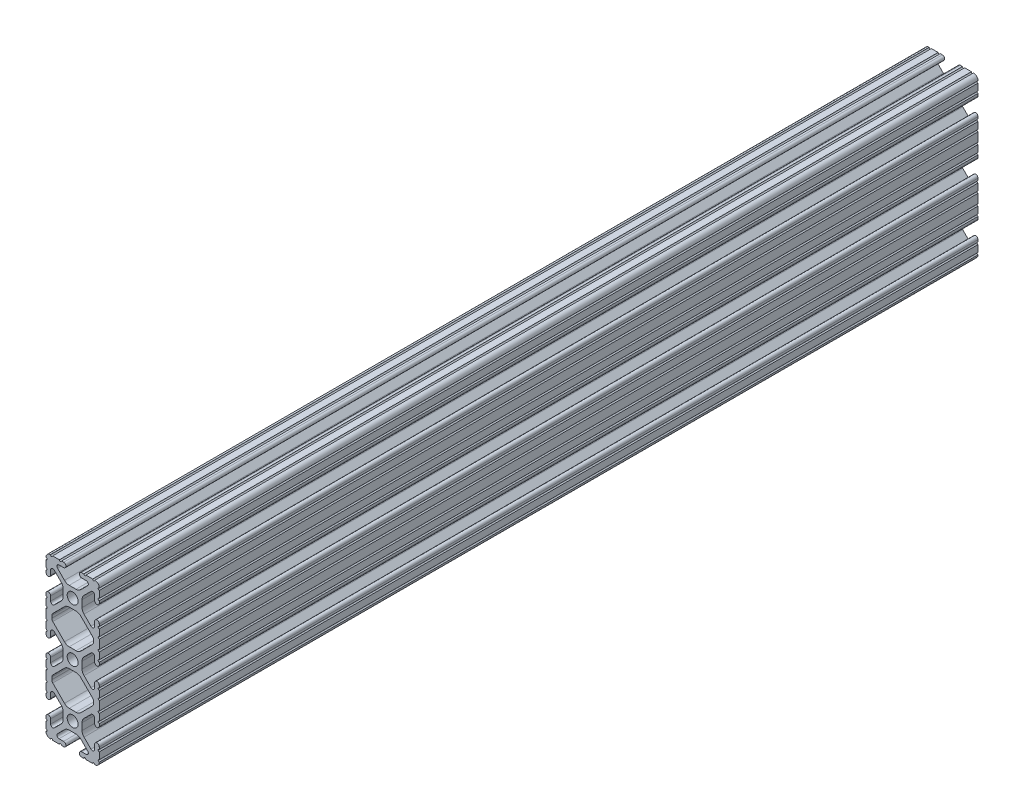
from build123d import *

# Parameters (mm, degrees)
SKETCH1_R           = 2.6035
BOSS_EXTRUDE1_DEPTH = 419.1


with BuildPart() as part:
    # Sketch1 → Boss-Extrude1 (new body)
    with BuildSketch(Plane.XY):
        with BuildLine():
            Line((-6.3246, 38.1), (-9.5504, 38.1))
            ThreePointArc((-9.5504, 38.1), (-10.0584, 37.592), (-10.5664, 38.1))
            ThreePointArc((-10.5664, 38.1), (-12.082677406, 37.482677406), (-12.7, 35.9664))
            ThreePointArc((-12.7, 35.9664), (-12.192, 35.4584), (-12.7, 34.9504))
            Line((-12.7, 34.9504), (-12.7, 31.7246))
            ThreePointArc((-12.7, 31.7246), (-12.192, 31.2166), (-12.7, 30.7086))
            Line((-12.7, 30.7086), (-12.7, 29.702307889))
            ThreePointArc((-12.7, 29.702307889), (-11.5951, 28.597407889), (-10.4902, 29.702307889))
            Line((-10.4902, 29.702307889), (-10.4902, 31.874794456))
            ThreePointArc((-10.4902, 31.874794456), (-9.863006367, 32.813456061), (-8.75577951, 32.593214945))
            Line((-8.75577951, 32.593214945), (-5.43843597, 29.275871405))
            ThreePointArc((-5.43843597, 29.275871405), (-4.750182484, 28.245827272), (-4.5085, 27.030807374))
            Line((-4.5085, 27.030807374), (-4.5085, 23.769192626))
            ThreePointArc((-4.5085, 23.769192626), (-4.750182484, 22.554172728), (-5.43843597, 21.524128595))
            Line((-5.43843597, 21.524128595), (-8.75577951, 18.206785055))
            ThreePointArc((-8.75577951, 18.206785055), (-9.863006367, 17.986543939), (-10.4902, 18.925205544))
            Line((-10.4902, 18.925205544), (-10.4902, 21.097692111))
            ThreePointArc((-10.4902, 21.097692111), (-11.5951, 22.202592111), (-12.7, 21.097692111))
            Line((-12.7, 21.097692111), (-12.7, 20.0914))
            ThreePointArc((-12.7, 20.0914), (-12.192, 19.5834), (-12.7, 19.0754))
            Line((-12.7, 19.0754), (-12.7, 15.8496))
            ThreePointArc((-12.7, 15.8496), (-12.192, 15.3416), (-12.7, 14.8336))
            Line((-12.7, 14.8336), (-12.7, 10.5664))
            ThreePointArc((-12.7, 10.5664), (-12.192, 10.0584), (-12.7, 9.5504))
            Line((-12.7, 9.5504), (-12.7, 6.3246))
            ThreePointArc((-12.7, 6.3246), (-12.192, 5.8166), (-12.7, 5.3086))
            Line((-12.7, 5.3086), (-12.7, 4.302307889))
            ThreePointArc((-12.7, 4.302307889), (-11.5951, 3.197407889), (-10.4902, 4.302307889))
            Line((-10.4902, 4.302307889), (-10.4902, 6.474794456))
            ThreePointArc((-10.4902, 6.474794456), (-9.863006367, 7.413456061), (-8.75577951, 7.193214945))
            Line((-8.75577951, 7.193214945), (-5.43843597, 3.875871405))
            ThreePointArc((-5.43843597, 3.875871405), (-4.750182484, 2.845827272), (-4.5085, 1.630807374))
            Line((-4.5085, 1.630807374), (-4.5085, -1.630807374))
            ThreePointArc((-4.5085, -1.630807374), (-4.750182484, -2.845827272), (-5.43843597, -3.875871405))
            Line((-5.43843597, -3.875871405), (-8.75577951, -7.193214945))
            ThreePointArc((-8.75577951, -7.193214945), (-9.863006367, -7.413456061), (-10.4902, -6.474794456))
            Line((-10.4902, -6.474794456), (-10.4902, -4.302307889))
            ThreePointArc((-10.4902, -4.302307889), (-11.5951, -3.197407889), (-12.7, -4.302307889))
            Line((-12.7, -4.302307889), (-12.7, -5.3086))
            ThreePointArc((-12.7, -5.3086), (-12.192, -5.8166), (-12.7, -6.3246))
            Line((-12.7, -6.3246), (-12.7, -9.5504))
            ThreePointArc((-12.7, -9.5504), (-12.192, -10.0584), (-12.7, -10.5664))
            Line((-12.7, -10.5664), (-12.7, -14.8336))
            ThreePointArc((-12.7, -14.8336), (-12.192, -15.3416), (-12.7, -15.8496))
            Line((-12.7, -15.8496), (-12.7, -19.0754))
            ThreePointArc((-12.7, -19.0754), (-12.192, -19.5834), (-12.7, -20.0914))
            Line((-12.7, -20.0914), (-12.7, -21.097692111))
            ThreePointArc((-12.7, -21.097692111), (-11.5951, -22.202592111), (-10.4902, -21.097692111))
            Line((-10.4902, -21.097692111), (-10.4902, -18.925205544))
            ThreePointArc((-10.4902, -18.925205544), (-9.863006367, -17.986543939), (-8.75577951, -18.206785055))
            Line((-8.75577951, -18.206785055), (-5.43843597, -21.524128595))
            ThreePointArc((-5.43843597, -21.524128595), (-4.750182484, -22.554172728), (-4.5085, -23.769192626))
            Line((-4.5085, -23.769192626), (-4.5085, -27.030807374))
            ThreePointArc((-4.5085, -27.030807374), (-4.750182484, -28.245827272), (-5.43843597, -29.275871405))
            Line((-5.43843597, -29.275871405), (-8.75577951, -32.593214945))
            ThreePointArc((-8.75577951, -32.593214945), (-9.863006367, -32.813456061), (-10.4902, -31.874794456))
            Line((-10.4902, -31.874794456), (-10.4902, -29.702307889))
            ThreePointArc((-10.4902, -29.702307889), (-11.5951, -28.597407889), (-12.7, -29.702307889))
            Line((-12.7, -29.702307889), (-12.7, -30.7086))
            ThreePointArc((-12.7, -30.7086), (-12.192, -31.2166), (-12.7, -31.7246))
            Line((-12.7, -31.7246), (-12.7, -34.9504))
            ThreePointArc((-12.7, -34.9504), (-12.192, -35.4584), (-12.7, -35.9664))
            ThreePointArc((-12.7, -35.9664), (-12.082677406, -37.482677406), (-10.5664, -38.1))
            ThreePointArc((-10.5664, -38.1), (-10.0584, -37.592), (-9.5504, -38.1))
            Line((-9.5504, -38.1), (-6.3246, -38.1))
            ThreePointArc((-6.3246, -38.1), (-5.8166, -37.592), (-5.3086, -38.1))
            Line((-5.3086, -38.1), (-4.302307889, -38.1))
            ThreePointArc((-4.302307889, -38.1), (-3.197407889, -36.9951), (-4.302307889, -35.8902))
            Line((-4.302307889, -35.8902), (-6.474794456, -35.8902))
            ThreePointArc((-6.474794456, -35.8902), (-7.413456061, -35.263006367), (-7.193214945, -34.15577951))
            Line((-7.193214945, -34.15577951), (-3.875871405, -30.83843597))
            ThreePointArc((-3.875871405, -30.83843597), (-2.845827272, -30.150182484), (-1.630807374, -29.9085))
            Line((-1.630807374, -29.9085), (1.630807374, -29.9085))
            ThreePointArc((1.630807374, -29.9085), (2.845827272, -30.150182484), (3.875871405, -30.83843597))
            Line((3.875871405, -30.83843597), (7.193214945, -34.15577951))
            ThreePointArc((7.193214945, -34.15577951), (7.413456061, -35.263006367), (6.474794456, -35.8902))
            Line((6.474794456, -35.8902), (4.302307889, -35.8902))
            ThreePointArc((4.302307889, -35.8902), (3.197407889, -36.9951), (4.302307889, -38.1))
            Line((4.302307889, -38.1), (5.3086, -38.1))
            ThreePointArc((5.3086, -38.1), (5.8166, -37.592), (6.3246, -38.1))
            Line((6.3246, -38.1), (9.5504, -38.1))
            ThreePointArc((9.5504, -38.1), (10.0584, -37.592), (10.5664, -38.1))
            ThreePointArc((10.5664, -38.1), (12.082677406, -37.482677406), (12.7, -35.9664))
            ThreePointArc((12.7, -35.9664), (12.192, -35.4584), (12.7, -34.9504))
            Line((12.7, -34.9504), (12.7, -31.7246))
            ThreePointArc((12.7, -31.7246), (12.192, -31.2166), (12.7, -30.7086))
            Line((12.7, -30.7086), (12.7, -29.702307918))
            ThreePointArc((12.7, -29.702307918), (11.5951, -28.597407918), (10.4902, -29.702307918))
            Line((10.4902, -29.702307918), (10.4902, -31.874794456))
            ThreePointArc((10.4902, -31.874794456), (9.863006367, -32.813456061), (8.75577951, -32.593214945))
            Line((8.75577951, -32.593214945), (5.43843597, -29.275871405))
            ThreePointArc((5.43843597, -29.275871405), (4.750182484, -28.245827272), (4.5085, -27.030807374))
            Line((4.5085, -27.030807374), (4.5085, -23.769192626))
            ThreePointArc((4.5085, -23.769192626), (4.750182484, -22.554172728), (5.43843597, -21.524128595))
            Line((5.43843597, -21.524128595), (8.75577951, -18.206785055))
            ThreePointArc((8.75577951, -18.206785055), (9.863006367, -17.986543939), (10.4902, -18.925205544))
            Line((10.4902, -18.925205544), (10.4902, -21.097692058))
            ThreePointArc((10.4902, -21.097692058), (11.5951, -22.202592058), (12.7, -21.097692058))
            Line((12.7, -21.097692058), (12.7, -20.0914))
            ThreePointArc((12.7, -20.0914), (12.192, -19.5834), (12.7, -19.0754))
            Line((12.7, -19.0754), (12.7, -15.8496))
            ThreePointArc((12.7, -15.8496), (12.192, -15.3416), (12.7, -14.8336))
            Line((12.7, -14.8336), (12.7, -10.5664))
            ThreePointArc((12.7, -10.5664), (12.192, -10.0584), (12.7, -9.5504))
            Line((12.7, -9.5504), (12.7, -6.3246))
            ThreePointArc((12.7, -6.3246), (12.192, -5.8166), (12.7, -5.3086))
            Line((12.7, -5.3086), (12.7, -4.302307889))
            ThreePointArc((12.7, -4.302307889), (11.5951, -3.197407889), (10.4902, -4.302307889))
            Line((10.4902, -4.302307889), (10.4902, -6.474794456))
            ThreePointArc((10.4902, -6.474794456), (9.863006367, -7.413456061), (8.75577951, -7.193214945))
            Line((8.75577951, -7.193214945), (5.43843597, -3.875871405))
            ThreePointArc((5.43843597, -3.875871405), (4.750182484, -2.845827272), (4.5085, -1.630807374))
            Line((4.5085, -1.630807374), (4.5085, 1.630807374))
            ThreePointArc((4.5085, 1.630807374), (4.750182484, 2.845827272), (5.43843597, 3.875871405))
            Line((5.43843597, 3.875871405), (8.75577951, 7.193214945))
            ThreePointArc((8.75577951, 7.193214945), (9.863006367, 7.413456061), (10.4902, 6.474794456))
            Line((10.4902, 6.474794456), (10.4902, 4.302307889))
            ThreePointArc((10.4902, 4.302307889), (11.5951, 3.197407889), (12.7, 4.302307889))
            Line((12.7, 4.302307889), (12.7, 5.3086))
            ThreePointArc((12.7, 5.3086), (12.192, 5.8166), (12.7, 6.3246))
            Line((12.7, 6.3246), (12.7, 9.5504))
            ThreePointArc((12.7, 9.5504), (12.192, 10.0584), (12.7, 10.5664))
            Line((12.7, 10.5664), (12.7, 14.8336))
            ThreePointArc((12.7, 14.8336), (12.192, 15.3416), (12.7, 15.8496))
            Line((12.7, 15.8496), (12.7, 19.0754))
            ThreePointArc((12.7, 19.0754), (12.192, 19.5834), (12.7, 20.0914))
            Line((12.7, 20.0914), (12.7, 21.097692082))
            ThreePointArc((12.7, 21.097692082), (11.5951, 22.202592082), (10.4902, 21.097692082))
            Line((10.4902, 21.097692082), (10.4902, 18.925205544))
            ThreePointArc((10.4902, 18.925205544), (9.863006367, 17.986543939), (8.75577951, 18.206785055))
            Line((8.75577951, 18.206785055), (5.43843597, 21.524128595))
            ThreePointArc((5.43843597, 21.524128595), (4.750182484, 22.554172728), (4.5085, 23.769192626))
            Line((4.5085, 23.769192626), (4.5085, 27.030807374))
            ThreePointArc((4.5085, 27.030807374), (4.750182484, 28.245827272), (5.43843597, 29.275871405))
            Line((5.43843597, 29.275871405), (8.75577951, 32.593214945))
            ThreePointArc((8.75577951, 32.593214945), (9.863006367, 32.813456061), (10.4902, 31.874794456))
            Line((10.4902, 31.874794456), (10.4902, 29.702307889))
            ThreePointArc((10.4902, 29.702307889), (11.5951, 28.597407889), (12.7, 29.702307889))
            Line((12.7, 29.702307889), (12.7, 30.7086))
            ThreePointArc((12.7, 30.7086), (12.192, 31.2166), (12.7, 31.7246))
            Line((12.7, 31.7246), (12.7, 34.9504))
            ThreePointArc((12.7, 34.9504), (12.192, 35.4584), (12.7, 35.9664))
            ThreePointArc((12.7, 35.9664), (12.082677406, 37.482677406), (10.5664, 38.1))
            ThreePointArc((10.5664, 38.1), (10.0584, 37.592), (9.5504, 38.1))
            Line((9.5504, 38.1), (6.3246, 38.1))
            ThreePointArc((6.3246, 38.1), (5.8166, 37.592), (5.3086, 38.1))
            Line((5.3086, 38.1), (4.302307889, 38.1))
            ThreePointArc((4.302307889, 38.1), (3.197407889, 36.9951), (4.302307889, 35.8902))
            Line((4.302307889, 35.8902), (6.474794456, 35.8902))
            ThreePointArc((6.474794456, 35.8902), (7.413456061, 35.263006367), (7.193214945, 34.15577951))
            Line((7.193214945, 34.15577951), (3.875871405, 30.83843597))
            ThreePointArc((3.875871405, 30.83843597), (2.845827272, 30.150182484), (1.630807374, 29.9085))
            Line((1.630807374, 29.9085), (-1.630807374, 29.9085))
            ThreePointArc((-1.630807374, 29.9085), (-2.845827272, 30.150182484), (-3.875871405, 30.83843597))
            Line((-3.875871405, 30.83843597), (-7.193214945, 34.15577951))
            ThreePointArc((-7.193214945, 34.15577951), (-7.413456061, 35.263006367), (-6.474794456, 35.8902))
            Line((-6.474794456, 35.8902), (-4.302307889, 35.8902))
            ThreePointArc((-4.302307889, 35.8902), (-3.197407889, 36.9951), (-4.302307889, 38.1))
            Line((-4.302307889, 38.1), (-5.3086, 38.1))
            ThreePointArc((-5.3086, 38.1), (-5.8166, 37.592), (-6.3246, 38.1))
        make_face()
        with Locations(Location((0, 25.4, 0), (0, 0, 180))):
            Circle(SKETCH1_R, mode=Mode.SUBTRACT)
        with Locations(Location((0, -25.4, 0), (0, 0, 180))):
            Circle(SKETCH1_R, mode=Mode.SUBTRACT)
        with Locations(Location((0, 0, 0), (0, 0, 180))):
            Circle(SKETCH1_R, mode=Mode.SUBTRACT)
        with BuildLine():
            Line((-9.9314, 12.146268083), (-9.9314, 13.253731917))
            ThreePointArc((-9.9314, 13.253731917), (-9.811525488, 13.856381786), (-9.470151759, 14.367283676))
            Line((-9.470151759, 14.367283676), (-3.875871405, 19.96156403))
            ThreePointArc((-3.875871405, 19.96156403), (-2.845827272, 20.649817516), (-1.630807374, 20.8915))
            Line((-1.630807374, 20.8915), (1.630807374, 20.8915))
            ThreePointArc((1.630807374, 20.8915), (2.845827272, 20.649817516), (3.875871405, 19.96156403))
            Line((3.875871405, 19.96156403), (9.470151759, 14.367283676))
            ThreePointArc((9.470151759, 14.367283676), (9.811525488, 13.856381786), (9.9314, 13.253731917))
            Line((9.9314, 13.253731917), (9.9314, 12.146268083))
            ThreePointArc((9.9314, 12.146268083), (9.811525488, 11.543618214), (9.470151759, 11.032716324))
            Line((9.470151759, 11.032716324), (3.875871405, 5.43843597))
            ThreePointArc((3.875871405, 5.43843597), (2.845827272, 4.750182484), (1.630807374, 4.5085))
            Line((1.630807374, 4.5085), (-1.630807374, 4.5085))
            ThreePointArc((-1.630807374, 4.5085), (-2.845827272, 4.750182484), (-3.875871405, 5.43843597))
            Line((-3.875871405, 5.43843597), (-9.470151759, 11.032716324))
            ThreePointArc((-9.470151759, 11.032716324), (-9.811525488, 11.543618214), (-9.9314, 12.146268083))
        make_face(mode=Mode.SUBTRACT)
        with BuildLine():
            Line((-9.9314, -13.253731917), (-9.9314, -12.146268083))
            ThreePointArc((-9.9314, -12.146268083), (-9.811525488, -11.543618214), (-9.470151759, -11.032716324))
            Line((-9.470151759, -11.032716324), (-3.875871405, -5.43843597))
            ThreePointArc((-3.875871405, -5.43843597), (-2.845827272, -4.750182484), (-1.630807374, -4.5085))
            Line((-1.630807374, -4.5085), (1.630807374, -4.5085))
            ThreePointArc((1.630807374, -4.5085), (2.845827272, -4.750182484), (3.875871405, -5.43843597))
            Line((3.875871405, -5.43843597), (9.470151759, -11.032716324))
            ThreePointArc((9.470151759, -11.032716324), (9.811525488, -11.543618214), (9.9314, -12.146268083))
            Line((9.9314, -12.146268083), (9.9314, -13.253731917))
            ThreePointArc((9.9314, -13.253731917), (9.811525488, -13.856381786), (9.470151759, -14.367283676))
            Line((9.470151759, -14.367283676), (3.875871405, -19.96156403))
            ThreePointArc((3.875871405, -19.96156403), (2.845827272, -20.649817516), (1.630807374, -20.8915))
            Line((1.630807374, -20.8915), (-1.630807374, -20.8915))
            ThreePointArc((-1.630807374, -20.8915), (-2.845827272, -20.649817516), (-3.875871405, -19.96156403))
            Line((-3.875871405, -19.96156403), (-9.470151759, -14.367283676))
            ThreePointArc((-9.470151759, -14.367283676), (-9.811525488, -13.856381786), (-9.9314, -13.253731917))
        make_face(mode=Mode.SUBTRACT)
    extrude(amount=-BOSS_EXTRUDE1_DEPTH)


solid = part.part
